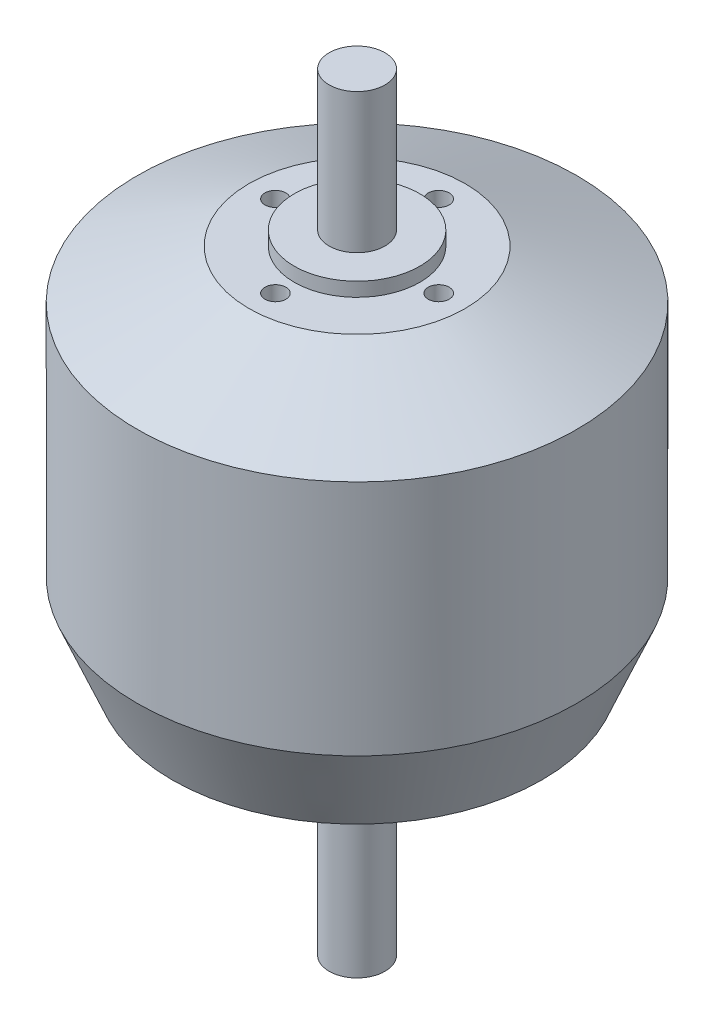
from build123d import *

# Parameters (mm, degrees)
SKETCH1_R           = 31.5
BOSS_EXTRUDE1_DEPTH = 55
CUT_EXTRUDE1_START  = 53
SKETCH1_4_R         = 31.5
SKETCH1_4_R_2       = 9
CUT_EXTRUDE1_DEPTH  = 2
SKETCH1_5_R         = 4
BOSS_EXTRUDE2_DEPTH = 35
SKETCH1_7_R         = 2
CUT_EXTRUDE2_DEPTH  = 10
CUT_EXTRUDE3_START  = 53
SKETCH1_10_R        = 1.5
CUT_EXTRUDE3_DEPTH  = 5
CHAMFER1_SIZE       = 5
CHAMFER1_SIZE2      = 12
CHAMFER2_SIZE       = 7
CHAMFER2_SIZE2      = 16
BOSS_EXTRUDE4_START = 75
SKETCH1_11_R        = 4
BOSS_EXTRUDE4_DEPTH = 20


with BuildPart() as part:
    # Sketch1 → Boss-Extrude1 (new body)
    with BuildSketch(Plane(origin=(0, 0, 0), x_dir=(1, 0, 0), z_dir=(0, 1, 0))):
        with Locations(Location((0, 0, 0), (0, 0, 270))):
            Circle(SKETCH1_R)
    extrude(amount=BOSS_EXTRUDE1_DEPTH)

    # Sketch1<4> → Cut-Extrude1 (cut)
    with BuildSketch(Plane(origin=(0, 0, 0), x_dir=(1, 0, 0), z_dir=(0, 1, 0)).offset(CUT_EXTRUDE1_START)):
        with Locations(Location((0, 0, 0), (0, 0, 270))):
            Circle(SKETCH1_4_R)
        with Locations(Location((0, 0, 0), (0, 0, 270))):
            Circle(SKETCH1_4_R_2, mode=Mode.SUBTRACT)
    extrude(amount=CUT_EXTRUDE1_DEPTH, mode=Mode.SUBTRACT)

    # Sketch1<5> → Boss-Extrude2 (add)
    with BuildSketch(Plane(origin=(0, 0, 0), x_dir=(1, 0, 0), z_dir=(0, 1, 0))):
        with Locations(Location((0, 0, 0), (0, 0, 270))):
            Circle(SKETCH1_5_R)
    extrude(amount=-BOSS_EXTRUDE2_DEPTH)

    # Sketch1<7> → Cut-Extrude2 (cut)
    with BuildSketch(Plane(origin=(0, 0, 0), x_dir=(1, 0, 0), z_dir=(0, 1, 0))):
        with Locations(Location((22.2, 0, 0), (0, 0, 270))):
            Circle(SKETCH1_7_R)
        with Locations(Location((0, 22.2, 0), (0, 0, 270))):
            Circle(SKETCH1_7_R)
        with Locations(Location((-22.2, 0, 0), (0, 0, 270))):
            Circle(SKETCH1_7_R)
        with Locations(Location((0, -22.2, 0), (0, 0, 270))):
            Circle(SKETCH1_7_R)
    extrude(amount=CUT_EXTRUDE2_DEPTH, mode=Mode.SUBTRACT)

    # Sketch1<10> → Cut-Extrude3 (cut)
    with BuildSketch(Plane(origin=(0, 0, 0), x_dir=(1, 0, 0), z_dir=(0, 1, 0)).offset(CUT_EXTRUDE3_START)):
        with Locations(Location((-11.7, 0, 0), (0, 0, 270))):
            Circle(SKETCH1_10_R)
        with Locations(Location((0, 11.7, 0), (0, 0, 270))):
            Circle(SKETCH1_10_R)
        with BuildLine():
            ThreePointArc((13.2, 0), (11.7, 1.5), (10.2, 0))
            Line((10.2, 0), (13.2, 0))
        make_face()
        with BuildLine():
            Line((13.2, 0), (10.2, 0))
            ThreePointArc((10.2, 0), (11.7, -1.5), (13.2, 0))
        make_face()
        with Locations(Location((0, -11.7, 0), (0, 0, 270))):
            Circle(SKETCH1_10_R)
    extrude(amount=-CUT_EXTRUDE3_DEPTH, mode=Mode.SUBTRACT)

    # Chamfer1
    chamfer1_edges = [part.edges().sort_by_distance(p)[0] for p in [
        (0, 0, -31.5),
    ]]
    chamfer1_side = [part.faces().sort_by_distance(p)[0] for p in [
        (0, 0, -30.609045456),
    ]]
    chamfer(chamfer1_edges, length=CHAMFER1_SIZE, length2=CHAMFER1_SIZE2, reference=chamfer1_side[0])

    # Chamfer2
    chamfer2_edges = [part.edges().sort_by_distance(p)[0] for p in [
        (0, 53, -31.5),
    ]]
    chamfer2_side = [part.faces().sort_by_distance(p)[0] for p in [
        (0, 32.5, -31.5),
    ]]
    chamfer(chamfer2_edges, length=CHAMFER2_SIZE, length2=CHAMFER2_SIZE2, reference=chamfer2_side[0])

    # Sketch1<11> → Boss-Extrude4 (add)
    with BuildSketch(Plane(origin=(0, 0, 0), x_dir=(1, 0, 0), z_dir=(0, 1, 0)).offset(BOSS_EXTRUDE4_START)):
        with Locations(Location((0, 0, 0), (0, 0, 270))):
            Circle(SKETCH1_11_R)
    extrude(amount=-BOSS_EXTRUDE4_DEPTH)


solid = part.part
